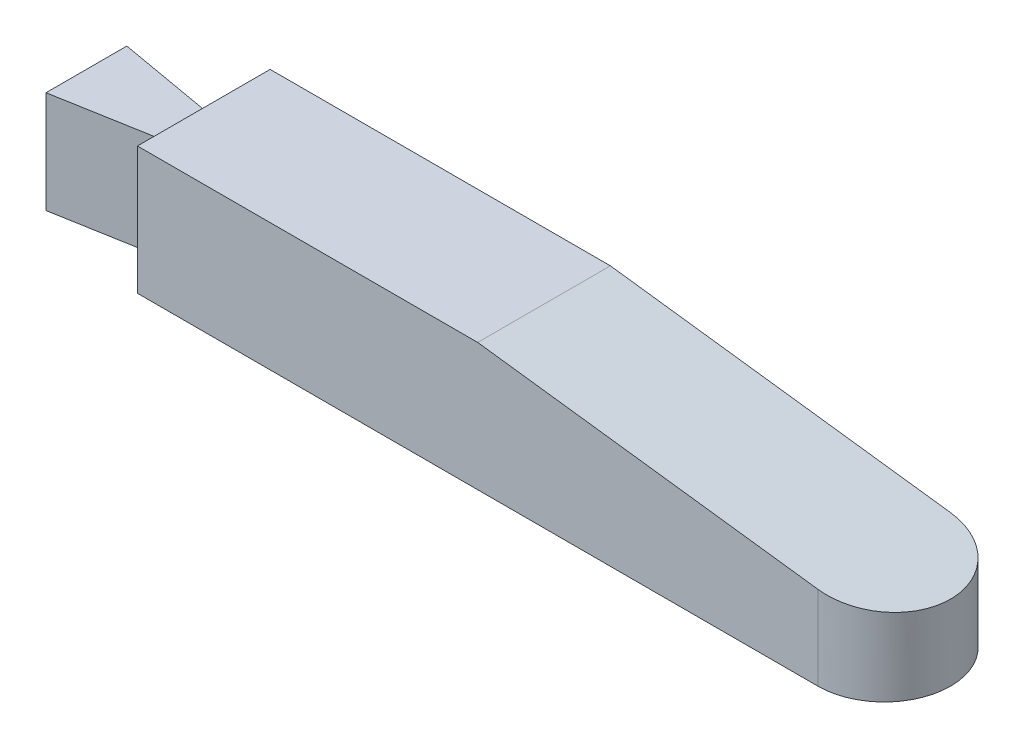
from build123d import *

# Parameters (mm, degrees)
BOSS_EXTRUDE1_DEPTH = 38.1
CUT_EXTRUDE1_DEPTH  = 7.62
CUT_EXTRUDE4_DEPTH  = 39.624


with BuildPart() as part:
    # Sketch2 → Boss-Extrude1 (new body)
    with BuildSketch(Plane(origin=(0, 0, 0), x_dir=(1, 0, 0), z_dir=(0, 1, 0))):
        with BuildLine():
            Line((-35.052, -7.747), (-35.052, -31.877))
            Line((-35.052, -31.877), (0, -25.696386672))
            Line((0, -25.696386672), (0, -39.624))
            Line((0, -39.624), (203.2, -39.624))
            ThreePointArc((203.2, -39.624), (223.012, -19.812), (203.2, 0))
            Line((203.2, 0), (0, 0))
            Line((0, 0), (0, -13.927613328))
            Line((0, -13.927613328), (-35.052, -7.747))
        make_face()
    extrude(amount=BOSS_EXTRUDE1_DEPTH)

    # Sketch3 → Cut-Extrude1 (cut)
    with BuildSketch(Plane(origin=(0, 38.1, 0), x_dir=(1, 0, 0), z_dir=(0, 1, 0))):
        Polygon((-35.052, -7.747), (-35.052, -31.877), (0, -25.696386672), (0, -13.927613328), align=None)
    extrude(amount=-CUT_EXTRUDE1_DEPTH, mode=Mode.SUBTRACT)

    # Sketch5 → Cut-Extrude4 (cut)
    with BuildSketch(Plane.XY.offset(39.624)):
        Polygon((101.6, 38.1), (223.012, 22.519655205), (223.012, 38.1), align=None)
    extrude(amount=-CUT_EXTRUDE4_DEPTH, mode=Mode.SUBTRACT)


solid = part.part
